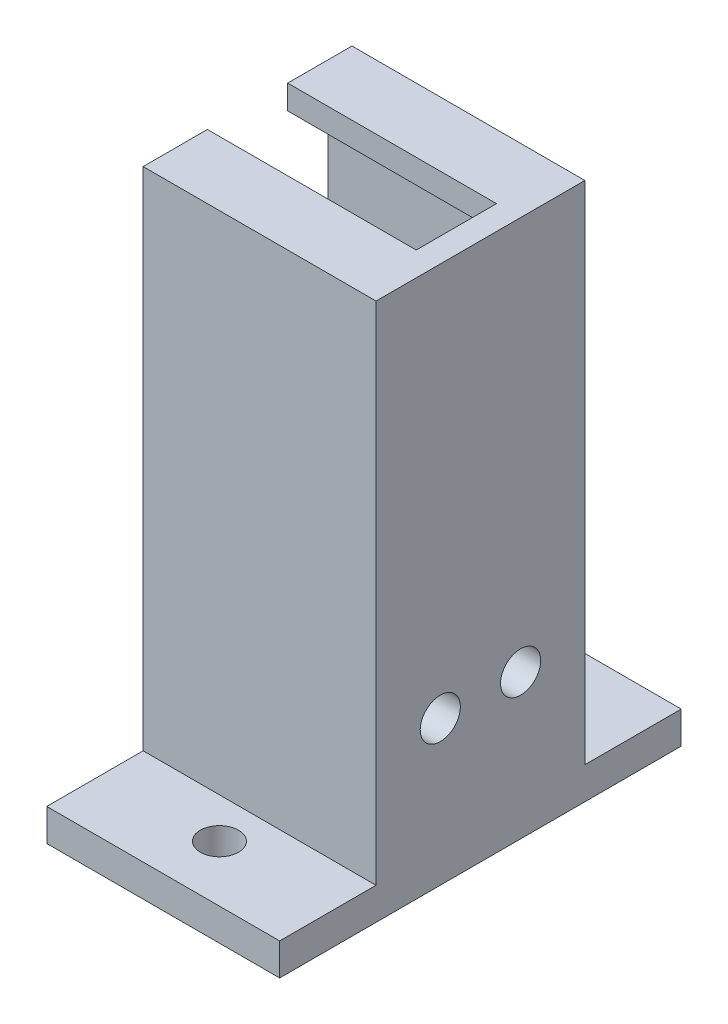
from build123d import *

# Parameters (mm, degrees)
SKETCH1_W           = 29
SKETCH1_H           = 47
BOSS_EXTRUDE1_DEPTH = 26
SHELL1_T            = -3
SKETCH2_W           = 10
SKETCH2_H           = 8.23076923
CUT_EXTRUDE1_DEPTH  = 26
SKETCH3_W           = 29
SKETCH3_H           = 26
BOSS_EXTRUDE2_DEPTH = 16
SKETCH4_R           = 2.5
CUT_EXTRUDE2_DEPTH  = 62.040969848
SKETCH5_W           = 29
SKETCH5_H           = 50
SKETCH5_R           = 2.38125
BOSS_EXTRUDE3_DEPTH = 4


with BuildPart() as part:
    # Sketch1 → Boss-Extrude1 (new body)
    with BuildSketch(Plane.XY):
        with Locations((14.5, 23.5)):
            Rectangle(SKETCH1_W, SKETCH1_H)
    extrude(amount=BOSS_EXTRUDE1_DEPTH)

    # Shell1
    shell1_openings = [part.faces().sort_by_distance(p)[0] for p in [
        (0, 23.5, 13),
    ]]
    offset(amount=SHELL1_T, openings=shell1_openings, kind=Kind.INTERSECTION)

    # Sketch2 → Cut-Extrude1 (cut)
    with BuildSketch(Plane.ZY):
        with Locations((13, 44)):
            Rectangle(SKETCH2_W, SKETCH2_H)
    extrude(amount=-CUT_EXTRUDE1_DEPTH, mode=Mode.SUBTRACT)

    # Sketch3 → Boss-Extrude2 (add)
    with BuildSketch(Plane.XZ):
        with Locations((14.5, 13)):
            Rectangle(SKETCH3_W, SKETCH3_H)
    extrude(amount=BOSS_EXTRUDE2_DEPTH)

    # Sketch4 → Cut-Extrude2 (cut, through all)
    with BuildSketch(Plane.ZY):
        with Locations(Location((8, -2, 0), (0, 0, 270))):
            Circle(SKETCH4_R)
        with Locations(Location((18, -2, 0), (0, 0, 270))):
            Circle(SKETCH4_R)
    extrude(amount=-CUT_EXTRUDE2_DEPTH, mode=Mode.SUBTRACT)

    # Sketch5 → Boss-Extrude3 (add)
    with BuildSketch(Plane.XZ.offset(16)):
        with Locations((14.5, 13)):
            Rectangle(SKETCH5_W, SKETCH5_H)
        with Locations(Location((14.5, 31, 0), (0, 0, 270))):
            Circle(SKETCH5_R, mode=Mode.SUBTRACT)
        with Locations(Location((14.5, -5, 0), (0, 0, 270))):
            Circle(SKETCH5_R, mode=Mode.SUBTRACT)
    extrude(amount=BOSS_EXTRUDE3_DEPTH)


solid = part.part
